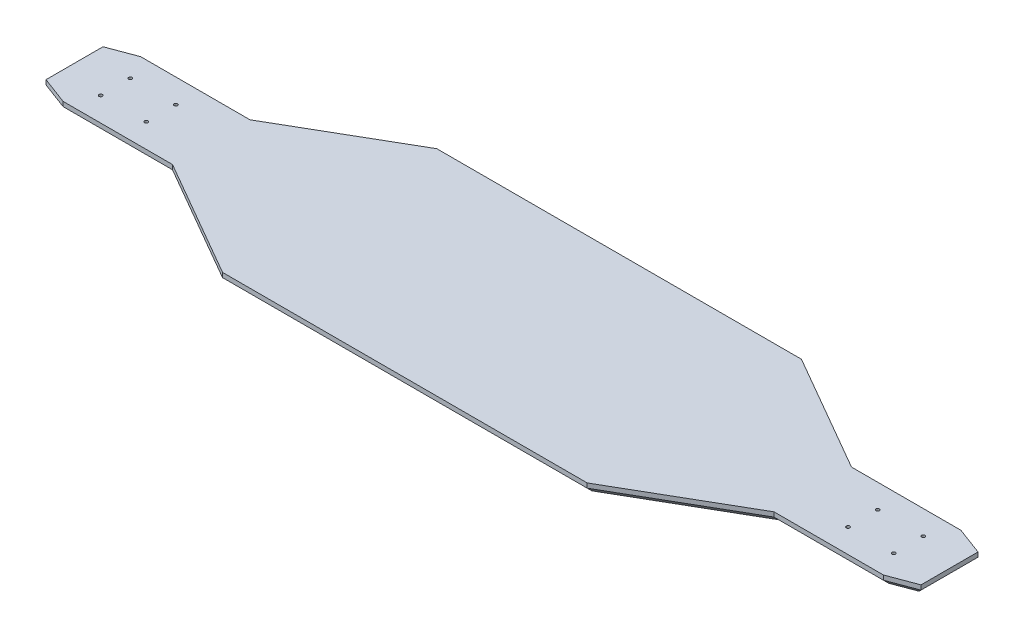
from build123d import *

# Parameters (mm, degrees)
BOSS_EXTRUDE1_DEPTH = 15.24
SKETCH2_R           = 2.38125
CUT_EXTRUDE1_DEPTH  = 15.24
CHAMFER1_SIZE       = 8.89


with BuildPart() as part:
    # Sketch1 → Boss-Extrude1 (new body)
    with BuildSketch(Plane(origin=(0, 0, 0), x_dir=(1, 0, 0), z_dir=(0, 1, 0))):
        Polygon((-241.141854356, 15.046517442), (-241.141854356, 94.421517442), (-203.041854356, 108.709017442), (-50.641854356, 108.709017442), (114.335985065, 203.959017442), (368.335985065, 203.959017442), (622.335985065, 203.959017442), (787.313824486, 108.709017442), (939.713824486, 108.709017442), (977.813824486, 94.421517442), (977.813824486, 15.046517442), (939.713824486, 0.759017442), (787.313824486, 0.759017442), (622.335985065, -94.490982558), (368.335985065, -94.490982558), (114.335985065, -94.490982558), (-50.641854356, 0.759017442), (-203.041854356, 0.759017442), align=None)
    extrude(amount=BOSS_EXTRUDE1_DEPTH)

    # Sketch2 → Cut-Extrude1 (cut)
    with BuildSketch(Plane(origin=(0, 0, 0), x_dir=(-1, 0, 0), z_dir=(0, -1, 0))):
        with Locations(Location((183.991854356, 34.096517442, 0), (0, 0, 90))):
            Circle(SKETCH2_R)
        with Locations(Location((183.991854356, 75.371517443, 0), (0, 0, 90))):
            Circle(SKETCH2_R)
        with Locations(Location((120.491854356, 75.371517443, 0), (0, 0, 90))):
            Circle(SKETCH2_R)
        with Locations(Location((120.491854356, 34.096517443, 0), (0, 0, 90))):
            Circle(SKETCH2_R)
        with Locations(Location((-857.163824486, 75.371517443, 0), (0, 0, 90))):
            Circle(SKETCH2_R)
        with Locations(Location((-920.663824486, 75.371517443, 0), (0, 0, 90))):
            Circle(SKETCH2_R)
        with Locations(Location((-920.663824486, 34.096517442, 0), (0, 0, 90))):
            Circle(SKETCH2_R)
        with Locations(Location((-857.163824486, 34.096517443, 0), (0, 0, 90))):
            Circle(SKETCH2_R)
    extrude(amount=-CUT_EXTRUDE1_DEPTH, mode=Mode.SUBTRACT)

    # Chamfer1
    chamfer1_edges = [part.edges().sort_by_distance(p)[0] for p in [
        (-126.841854356, 0, -0.759017442),
        (-222.091854356, 0, -7.902767442),
        (-241.141854356, 0, -54.734017442),
        (-222.091854356, 0, -101.565267442),
        (-126.841854356, 0, -108.709017442),
        (31.847065354, 0, -156.334017442),
        (368.335985065, 0, -203.959017442),
        (704.824904775, 0, -156.334017442),
        (863.513824486, 0, -108.709017442),
        (958.763824486, 0, -101.565267442),
        (977.813824486, 0, -54.734017442),
        (958.763824486, 0, -7.902767442),
        (863.513824486, 0, -0.759017442),
        (704.824904775, 0, 46.865982558),
        (368.335985065, 0, 94.490982558),
        (31.847065354, 0, 46.865982558),
    ]]
    chamfer(chamfer1_edges, length=CHAMFER1_SIZE)


solid = part.part
